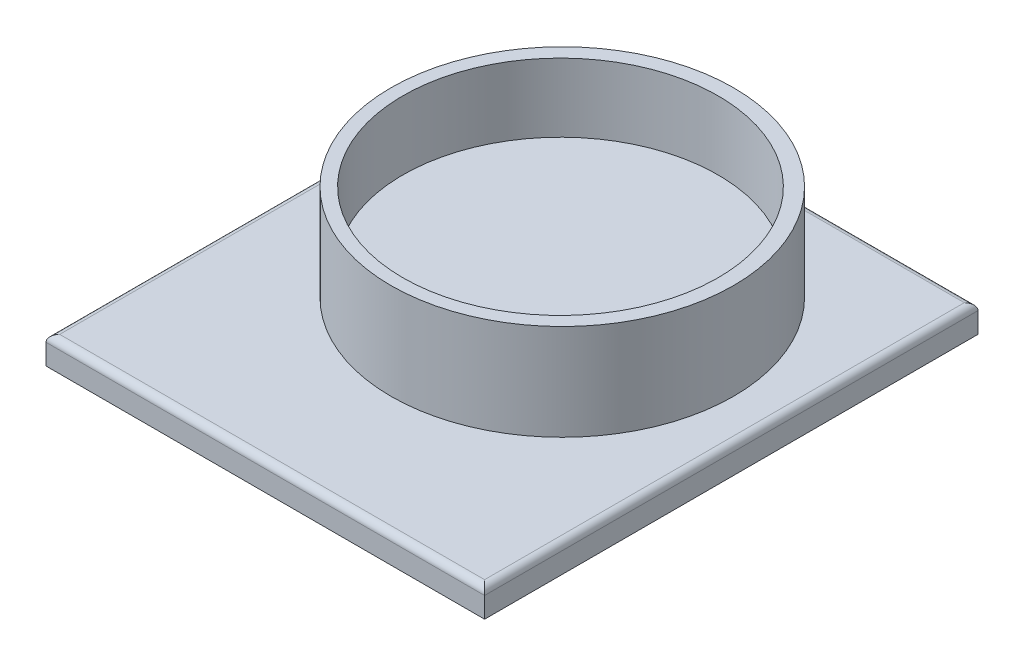
from build123d import *

# Parameters (mm, degrees)
SKETCH_1_W          = 32
SKETCH_1_H          = 36
EXTRUDE_1_DEPTH     = 2
FILLET_3_R          = 0.5
SKETCH_2_R          = 12.5
EXTRUDE_2_DEPTH     = 7
SKETCH_3_R          = 11.5
SKETCH_3_R_2        = 0.070206985
CUT_EXTRUDE_1_DEPTH = 5


with BuildPart() as part:
    # 草图1 → 凸台-拉伸1 (new body)
    with BuildSketch(Plane(origin=(0, 0, 0), x_dir=(1, 0, 0), z_dir=(0, 1, 0))):
        with Locations((16, 18)):
            Rectangle(SKETCH_1_W, SKETCH_1_H)
    extrude(amount=EXTRUDE_1_DEPTH)

    # 圆角3
    fillet_3_edges = [part.edges().sort_by_distance(p)[0] for p in [
        (32, 2, -18),
        (16, 2, -36),
        (0, 2, -18),
        (16, 2, 0),
    ]]
    fillet(fillet_3_edges, radius=FILLET_3_R)

    # 草图2 → 凸台-拉伸2 (add)
    with BuildSketch(Plane(origin=(0, 2, 0), x_dir=(1, 0, 0), z_dir=(0, 1, 0))):
        with Locations(Location((16.5, 21.167902567, 0), (0, 0, 90))):
            Circle(SKETCH_2_R)
    extrude(amount=EXTRUDE_2_DEPTH)

    # 草图3 → 切除-拉伸1 (cut)
    with BuildSketch(Plane(origin=(0, 9, 0), x_dir=(1, 0, 0), z_dir=(0, 1, 0))):
        with Locations(Location((16.442109052, 21.094763366, 0), (0, 0, 270))):
            Circle(SKETCH_3_R)
        with Locations((0, 24.191575331)):
            Circle(SKETCH_3_R_2)
    extrude(amount=-CUT_EXTRUDE_1_DEPTH, mode=Mode.SUBTRACT)


solid = part.part
